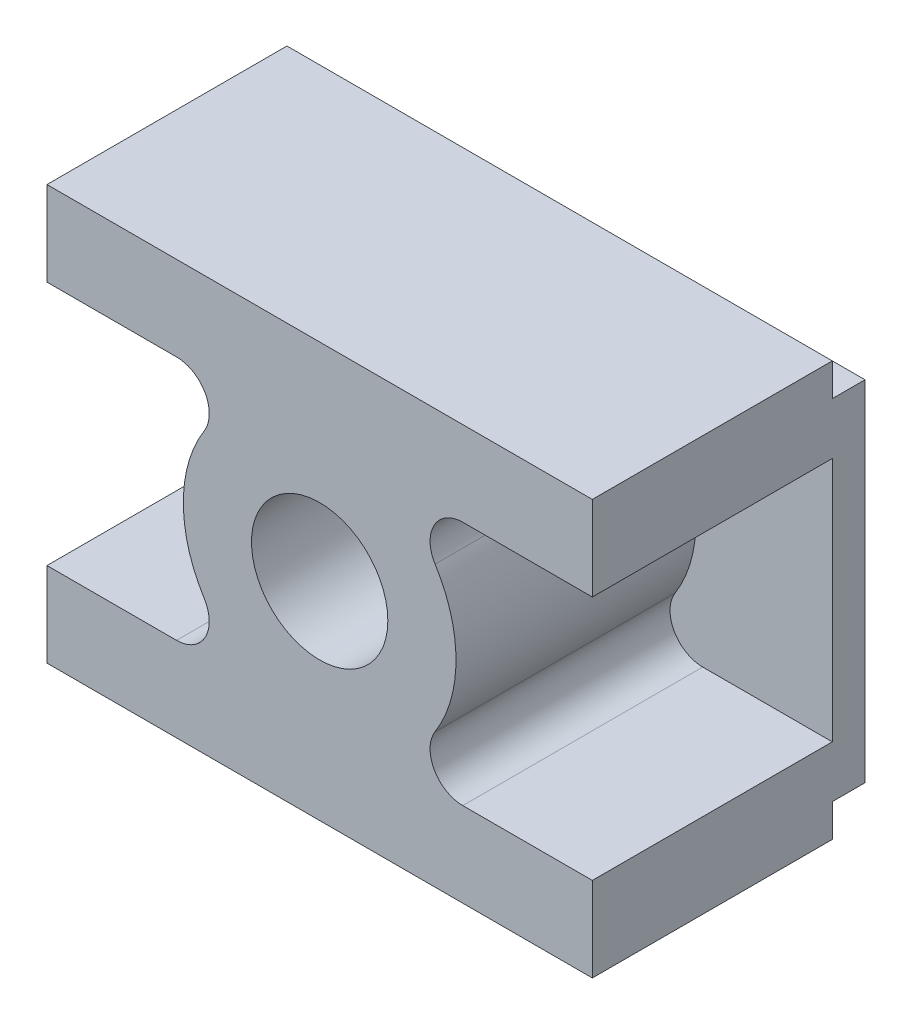
from build123d import *

# Parameters (mm, degrees)
SKETCH1_R           = 12.5
BOSS_EXTRUDE1_DEPTH = 50
BOSS_EXTRUDE2_DEPTH = 6
SKETCH3_W           = 6
SKETCH3_H           = 6
CUT_EXTRUDE1_DEPTH  = 119.084715353


with BuildPart() as part:
    # Sketch1 → Boss-Extrude1 (new body)
    with BuildSketch(Plane.XY):
        with BuildLine():
            ThreePointArc((21.164553987, 13.306451613), (20.992319118, 19.401612455), (26.244046944, 22.5))
            Line((26.244046944, 22.5), (50, 22.5))
            Line((50, 22.5), (50, 38))
            Line((50, 38), (-50, 38))
            Line((-50, 38), (-50, 22.5))
            Line((-50, 22.5), (-26.244046944, 22.5))
            ThreePointArc((-26.244046944, 22.5), (-20.992319118, 19.401612455), (-21.164553987, 13.306451613))
            ThreePointArc((-21.164553987, 13.306451613), (-25, 0), (-21.164553987, -13.306451613))
            ThreePointArc((-21.164553987, -13.306451613), (-20.992319118, -19.401612455), (-26.244046944, -22.5))
            Line((-26.244046944, -22.5), (-50, -22.5))
            Line((-50, -22.5), (-50, -38))
            Line((-50, -38), (50, -38))
            Line((50, -38), (50, -22.5))
            Line((50, -22.5), (26.244046944, -22.5))
            ThreePointArc((26.244046944, -22.5), (20.992319118, -19.401612455), (21.164553987, -13.306451613))
            ThreePointArc((21.164553987, -13.306451613), (25, 0), (21.164553987, 13.306451613))
        make_face()
        Circle(SKETCH1_R, mode=Mode.SUBTRACT)
    extrude(amount=BOSS_EXTRUDE1_DEPTH)

    # Sketch2 → Boss-Extrude2 (add)
    with BuildSketch(Plane(origin=(0, 0, 0), x_dir=(-1, 0, 0), z_dir=(0, 0, -1))):
        with BuildLine():
            Line((50, -22.5), (26.244046944, -22.5))
            ThreePointArc((26.244046944, -22.5), (20.992319118, -19.401612455), (21.164553987, -13.306451613))
            ThreePointArc((21.164553987, -13.306451613), (25, 0), (21.164553987, 13.306451613))
            ThreePointArc((21.164553987, 13.306451613), (20.992319118, 19.401612455), (26.244046944, 22.5))
            Line((26.244046944, 22.5), (50, 22.5))
            Line((50, 22.5), (50, -22.5))
        make_face()
        with BuildLine():
            Line((-26.244046944, -22.5), (-50, -22.5))
            Line((-50, -22.5), (-50, 22.5))
            Line((-50, 22.5), (-26.244046944, 22.5))
            ThreePointArc((-26.244046944, 22.5), (-20.992319118, 19.401612455), (-21.164553987, 13.306451613))
            ThreePointArc((-21.164553987, 13.306451613), (-25, 0), (-21.164553987, -13.306451613))
            ThreePointArc((-21.164553987, -13.306451613), (-20.992319118, -19.401612455), (-26.244046944, -22.5))
        make_face()
    extrude(amount=-BOSS_EXTRUDE2_DEPTH)

    # Sketch3 → Cut-Extrude1 (cut, through all)
    with BuildSketch(Plane(origin=(50, 0, 0), x_dir=(0, 0, -1), z_dir=(1, 0, 0))):
        with Locations((-3, 35)):
            Rectangle(SKETCH3_W, SKETCH3_H)
        with Locations((-3, -35)):
            Rectangle(SKETCH3_W, SKETCH3_H)
    extrude(amount=-CUT_EXTRUDE1_DEPTH, mode=Mode.SUBTRACT)


solid = part.part
